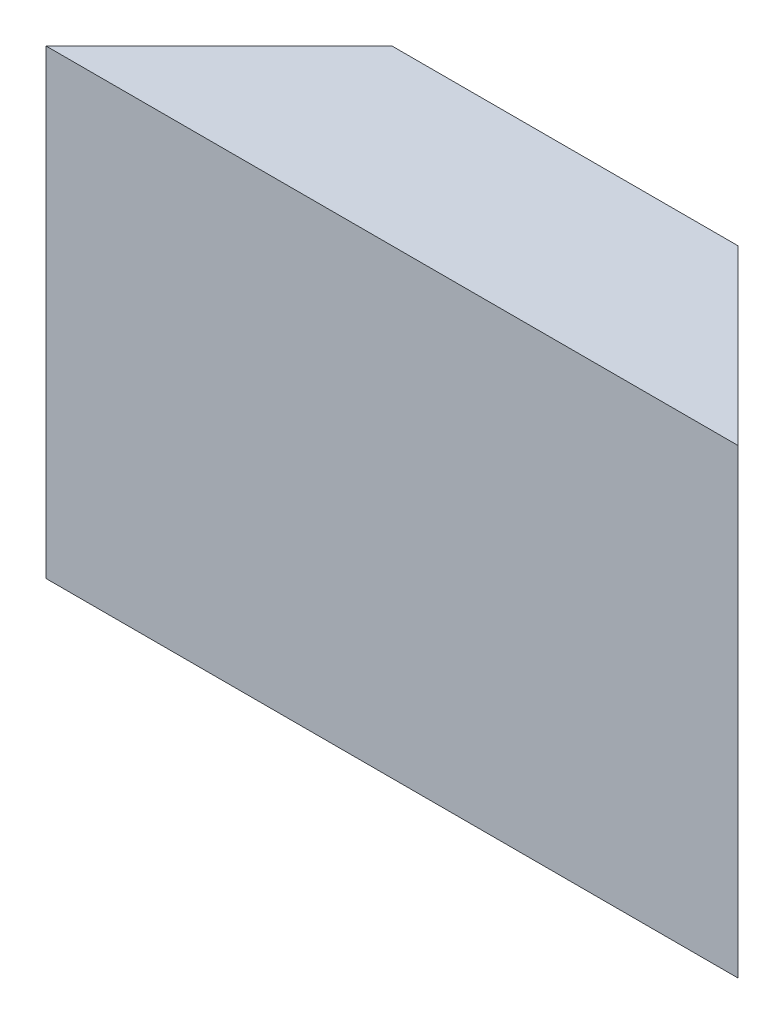
from build123d import *

# Parameters (mm, degrees)
EXTRUDE_1_DEPTH = 40


with BuildPart() as part:
    # 草圖1 → 填料-伸長1 (new body)
    with BuildSketch(Plane(origin=(0, 0, 0), x_dir=(1, 0, 0), z_dir=(0, 1, 0))):
        Polygon((0, 0), (60, 0), (45, 15), (15, 15), align=None)
    extrude(amount=EXTRUDE_1_DEPTH)


solid = part.part
